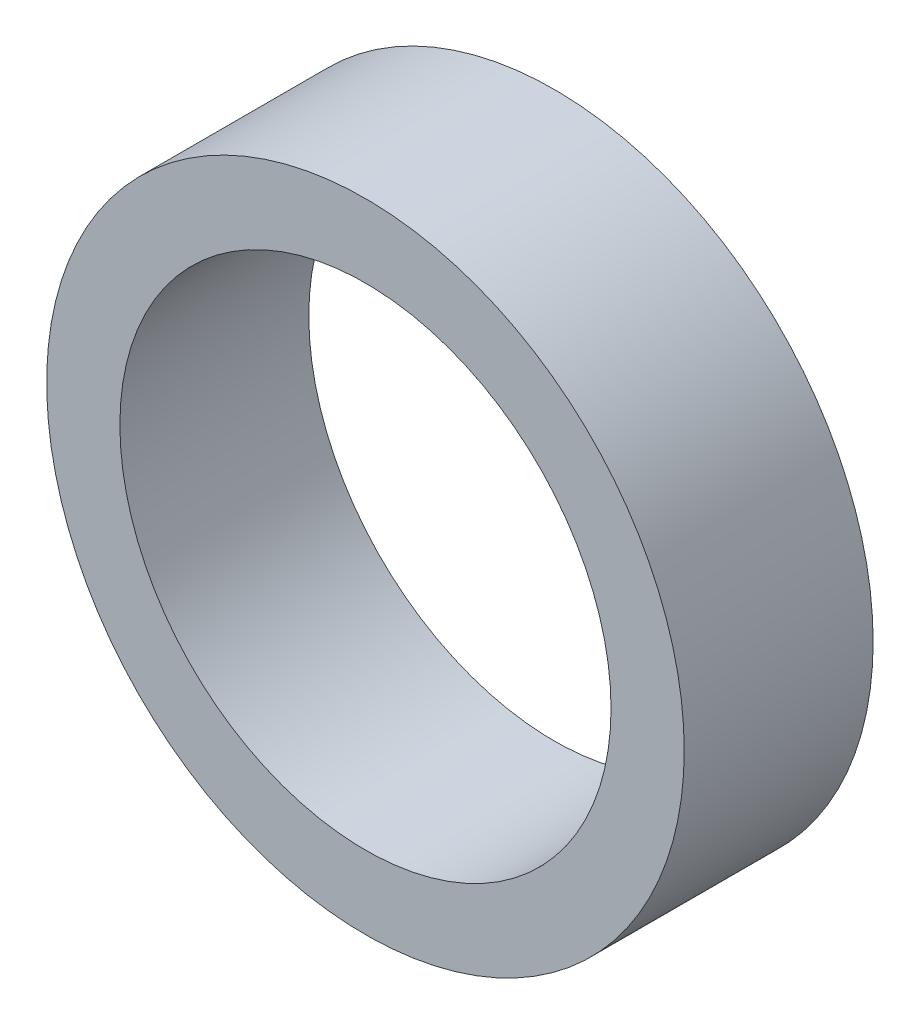
from build123d import *

# Parameters (mm, degrees)
SKETCH_1_R      = 6.75
SKETCH_1_R_2    = 5.2
EXTRUDE_1_DEPTH = 4


with BuildPart() as part:
    # 草图1 → 凸台-拉伸1 (new body)
    with BuildSketch(Plane.XY):
        Circle(SKETCH_1_R)
        Circle(SKETCH_1_R_2, mode=Mode.SUBTRACT)
    extrude(amount=EXTRUDE_1_DEPTH)


solid = part.part
